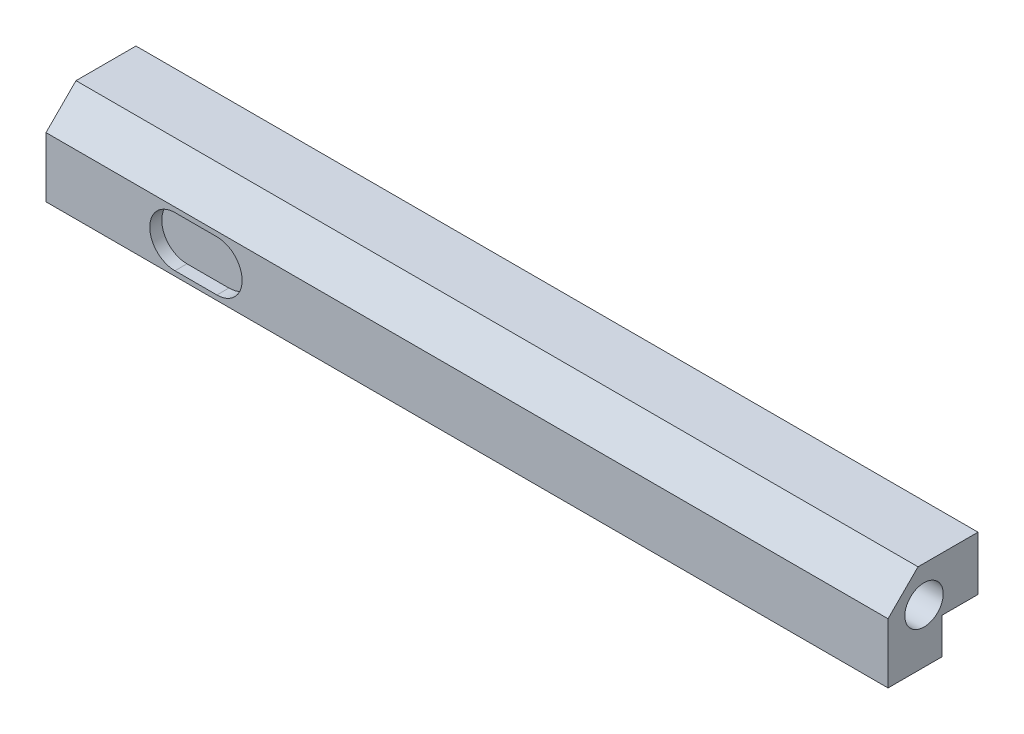
from build123d import *

# Parameters (mm, degrees)
ESQUISSE3_R             = 2.35
BOSS_EXTRU_2_DEPTH      = 70.2
CHANFREIN1_SIZE         = 5
ESQUISSE6_R             = 3.2
ESQUISSE6_R_2           = 2.35
ENL_V_MAT_EXTRU_1_DEPTH = 7
ENL_V_START             = -7
ESQUISSE7_R             = 3.2
ESQUISSE7_R_2           = 2.35
ENL_V_MAT_EXTRU_2_DEPTH = 7
ENL_V_MAT_EXTRU_4_DEPTH = 2


with BuildPart() as part:
    # Esquisse3 → Boss.-Extru.2 (new, symmetric)
    with BuildSketch(Plane(origin=(0, 0, 0), x_dir=(0, 0, -1), z_dir=(1, 0, 0))):
        Polygon((-4.5, -10.5), (-4.5, 4.5), (10.5, 4.5), (10.5, -4.5), (4.5, -4.5), (4.5, -10.5), align=None)
        with Locations((1.5, -1.5)):
            Circle(ESQUISSE3_R, mode=Mode.SUBTRACT)
    extrude(amount=BOSS_EXTRU_2_DEPTH, both=True)

    # Chanfrein1
    chanfrein1_edges = [part.edges().sort_by_distance(p)[0] for p in [
        (0, 4.5, 4.5),
    ]]
    chamfer(chanfrein1_edges, length=CHANFREIN1_SIZE)

    # Esquisse6 → Enlèv. mat.-Extru.1 (cut)
    with BuildSketch(Plane.ZY.offset(70.2)):
        with Locations((-1.5, -1.5)):
            Circle(ESQUISSE6_R)
        with Locations((-1.5, -1.5)):
            Circle(ESQUISSE6_R_2, mode=Mode.SUBTRACT)
    extrude(amount=-ENL_V_MAT_EXTRU_1_DEPTH, mode=Mode.SUBTRACT)

    # Esquisse7 → Enlèv. mat.-Extru.2 (cut)
    with BuildSketch(Plane(origin=(70.2, 0, 0), x_dir=(0, 0, -1), z_dir=(1, 0, 0)).offset(ENL_V_START)):
        with Locations(Location((1.5, -1.5, 0), (0, 0, 180))):
            Circle(ESQUISSE7_R)
        with Locations(Location((1.5, -1.5, 0), (0, 0, 180))):
            Circle(ESQUISSE7_R_2, mode=Mode.SUBTRACT)
    extrude(amount=ENL_V_MAT_EXTRU_2_DEPTH, mode=Mode.SUBTRACT)

    # Esquisse9 → Enlèv. mat.-Extru.4 (cut)
    with BuildSketch(Plane.XY.offset(4.5)):
        with BuildLine():
            Line((-48.7, -1.3), (-41.7, -1.3))
            ThreePointArc((-41.7, -1.3), (-37.5, -5.5), (-41.7, -9.7))
            Line((-41.7, -9.7), (-48.7, -9.7))
            ThreePointArc((-48.7, -9.7), (-52.9, -5.5), (-48.7, -1.3))
        make_face()
    extrude(amount=-ENL_V_MAT_EXTRU_4_DEPTH, mode=Mode.SUBTRACT)


solid = part.part
